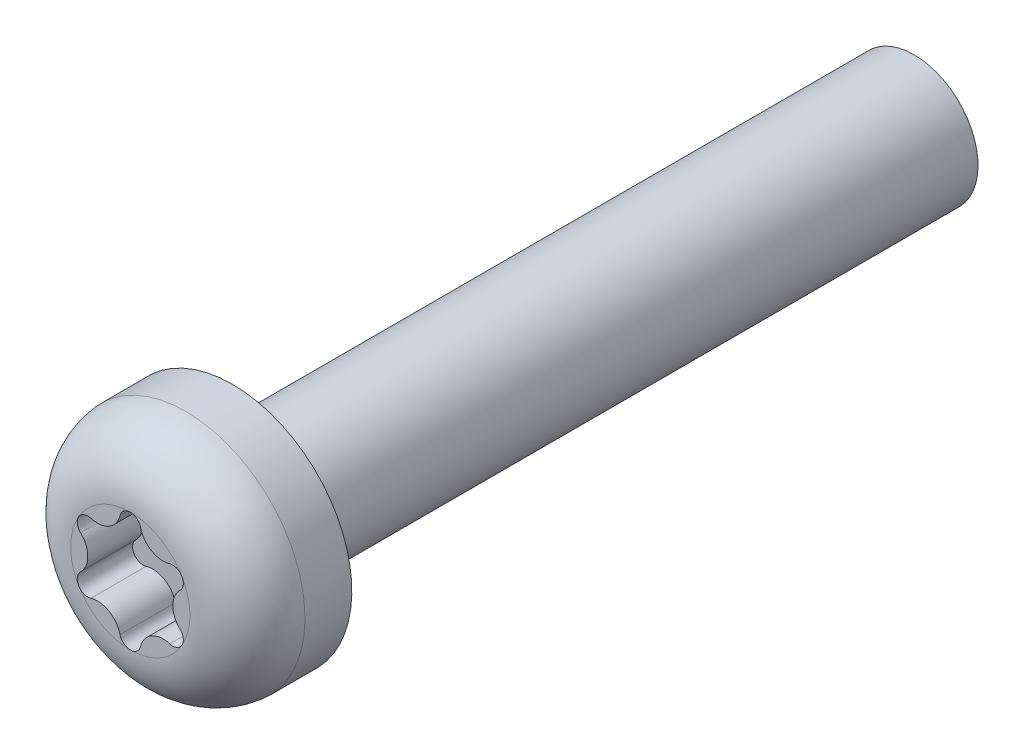
from build123d import *

# Parameters (mm, degrees)
ENL_V_MAT_EXTRU_1_DEPTH = 1.3


with BuildPart() as part:
    # Esquisse1 → Révolution1 (revolve)
    with BuildSketch(Plane(origin=(0, 0, 0), x_dir=(0, 0, -1), z_dir=(1, 0, 0))):
        with BuildLine():
            Line((-2.4, 0), (-2.4, 1.4))
            ThreePointArc((-2.4, 1.4), (-2.024883171, 2.355248659), (-1.1, 2.8))
            Line((-1.1, 2.8), (0, 2.8))
            Line((0, 2.8), (0, 1.5))
            Line((0, 1.5), (16, 1.5))
            Line((16, 1.5), (16, 0))
            Line((16, 0), (-2.4, 0))
        make_face()
    revolve(axis=Axis((0, 0, 2.4), (0, 0, 1)))

    # Esquisse2 → Enlèv. mat.-Extru.1 (cut)
    with BuildSketch(Plane.XY.offset(2.4)):
        with BuildLine():
            ThreePointArc((-0.240728142, 1.210222096), (0, 1.4), (0.240728142, 1.210222096))
            ThreePointArc((0.240728142, 1.210222096), (0.499017901, 0.864324358), (0.927719008, 0.813587734))
            ThreePointArc((0.927719008, 0.813587734), (1.212435565, 0.7), (1.16844715, 0.396634361))
            ThreePointArc((1.16844715, 0.396634361), (0.998035801, 0), (1.16844715, -0.396634361))
            ThreePointArc((1.16844715, -0.396634361), (1.212435565, -0.7), (0.927719008, -0.813587734))
            ThreePointArc((0.927719008, -0.813587734), (0.499017901, -0.864324358), (0.240728142, -1.210222096))
            ThreePointArc((0.240728142, -1.210222096), (0, -1.4), (-0.240728142, -1.210222096))
            ThreePointArc((-0.240728142, -1.210222096), (-0.499017901, -0.864324358), (-0.927719008, -0.813587734))
            ThreePointArc((-0.927719008, -0.813587734), (-1.212435565, -0.7), (-1.16844715, -0.396634361))
            ThreePointArc((-1.16844715, -0.396634361), (-0.998035801, 0), (-1.16844715, 0.396634361))
            ThreePointArc((-1.16844715, 0.396634361), (-1.212435565, 0.7), (-0.927719008, 0.813587734))
            ThreePointArc((-0.927719008, 0.813587734), (-0.499017901, 0.864324358), (-0.240728142, 1.210222096))
        make_face()
    extrude(amount=-ENL_V_MAT_EXTRU_1_DEPTH, mode=Mode.SUBTRACT)


solid = part.part
